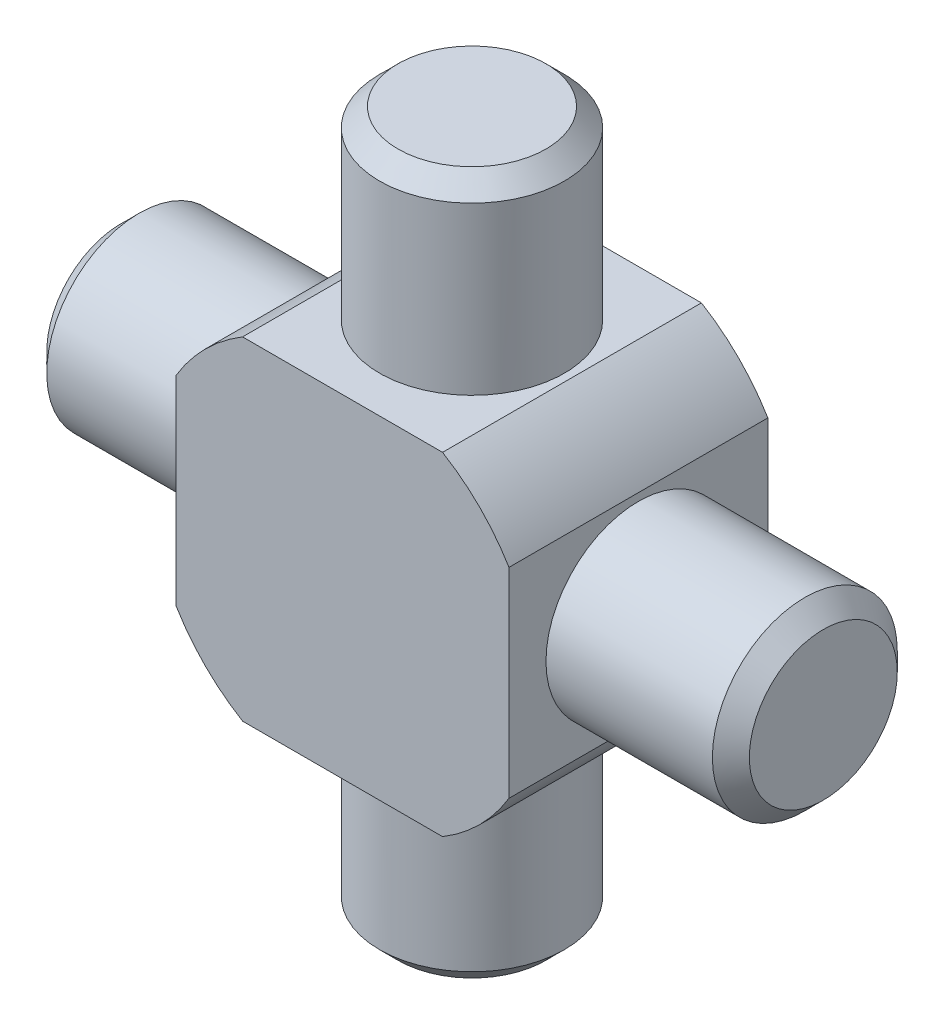
from build123d import *

# Parameters (mm, degrees)
BASE_EXTRUSION_DEPTH      = 7
BASE_EXTRUSION_DEPTH_BACK = 7
BOSS_EXTRU_4_DEPTH        = 19
BOSS_EXTRU_4_DEPTH_BACK   = 19
ESQUISSE8_R               = 5
BOSS_EXTRU_5_DEPTH        = 19
BOSS_EXTRU_5_DEPTH_BACK   = 19
ESQUISSE9_R               = 5
CHANFREIN2_SIZE           = 1


with BuildPart() as part:
    # Esquisse1 → Base-Extrusion (new, two sides: drawn at the far end of the back side and taken through both)
    with BuildSketch(Plane.XY.offset(-BASE_EXTRUSION_DEPTH_BACK)):
        with BuildLine():
            Line((-5.408326913, 9), (5.408326913, 9))
            ThreePointArc((5.408326913, 9), (7.424621202, 7.424621202), (9, 5.408326913))
            Line((9, 5.408326913), (9, -5.408326913))
            ThreePointArc((9, -5.408326913), (7.424621202, -7.424621202), (5.408326913, -9))
            Line((5.408326913, -9), (-5.408326913, -9))
            ThreePointArc((-5.408326913, -9), (-7.424621202, -7.424621202), (-9, -5.408326913))
            Line((-9, -5.408326913), (-9, 5.408326913))
            ThreePointArc((-9, 5.408326913), (-7.424621202, 7.424621202), (-5.408326913, 9))
        make_face()
    extrude(amount=BASE_EXTRUSION_DEPTH + BASE_EXTRUSION_DEPTH_BACK)

    # Esquisse8 → Boss.-Extru.4 (add, two sides: drawn at the far end of the back side and taken through both)
    with BuildSketch(Plane(origin=(0, 0, 0), x_dir=(1, 0, 0), z_dir=(0, 1, 0)).offset(-BOSS_EXTRU_4_DEPTH_BACK)):
        with Locations(Location((0, 0, 0), (0, 0, 90))):
            Circle(ESQUISSE8_R)
    extrude(amount=BOSS_EXTRU_4_DEPTH + BOSS_EXTRU_4_DEPTH_BACK)

    # Esquisse9 → Boss.-Extru.5 (add, two sides: drawn at the far end of the back side and taken through both)
    with BuildSketch(Plane(origin=(0, 0, 0), x_dir=(0, 0, -1), z_dir=(1, 0, 0)).offset(-BOSS_EXTRU_5_DEPTH_BACK)):
        with Locations(Location((0, 0, 0), (0, 0, 180))):
            Circle(ESQUISSE9_R)
    extrude(amount=BOSS_EXTRU_5_DEPTH + BOSS_EXTRU_5_DEPTH_BACK)

    # Chanfrein2
    chanfrein2_edges = [part.edges().sort_by_distance(p)[0] for p in [
        (0, 19, 5),
        (-19, 0, -5),
        (19, 0, -5),
        (0, -19, 5),
    ]]
    chamfer(chanfrein2_edges, length=CHANFREIN2_SIZE)


solid = part.part
